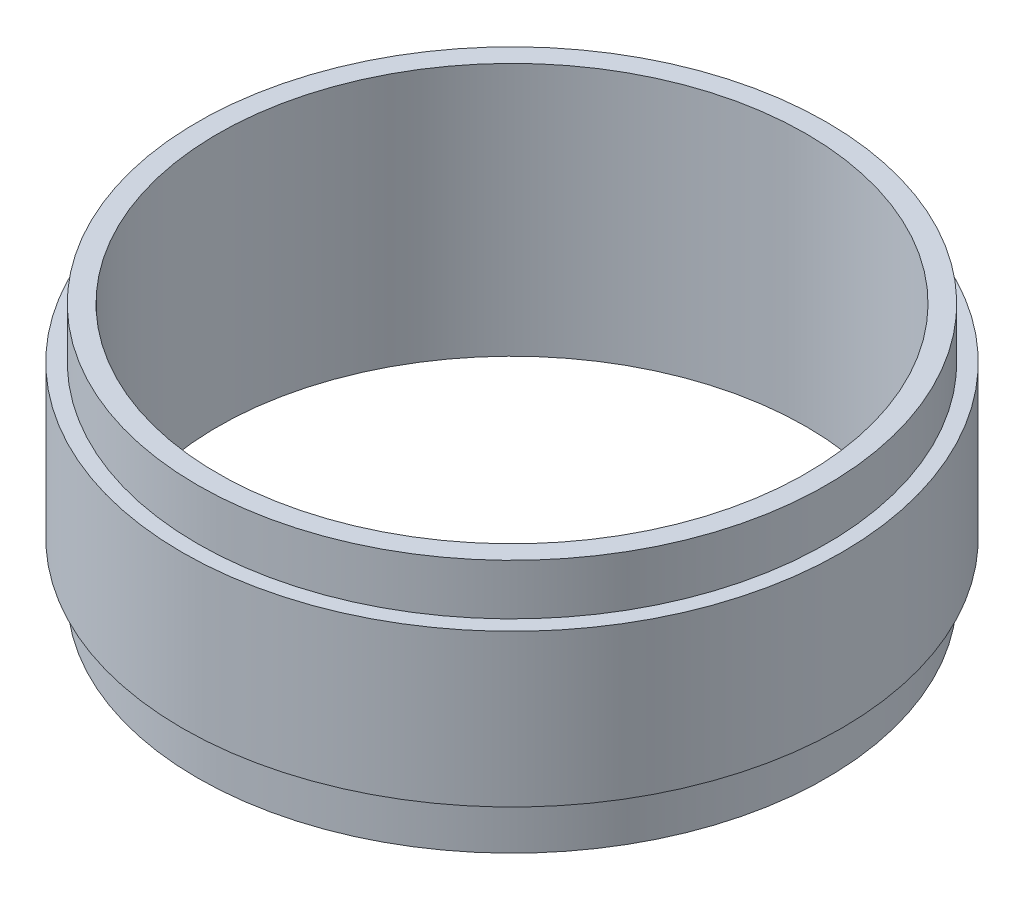
from build123d import *


with BuildPart() as part:
    # Szkic1 → Obrót1 (revolve)
    with BuildSketch(Plane.XY, mode=Mode.PRIVATE) as obr_t1_sk:
        Polygon((-62, 0), (-58, 0), (-58, 50), (-62, 50), (-62, 40), (-65, 40), (-65, 10), (-62, 10), align=None)
    revolve(obr_t1_sk.sketch.rotate(Axis((0, 0, 0), (0, 1, 0)), 270), axis=Axis((0, 0, 0), (0, 1, 0)))


solid = part.part
